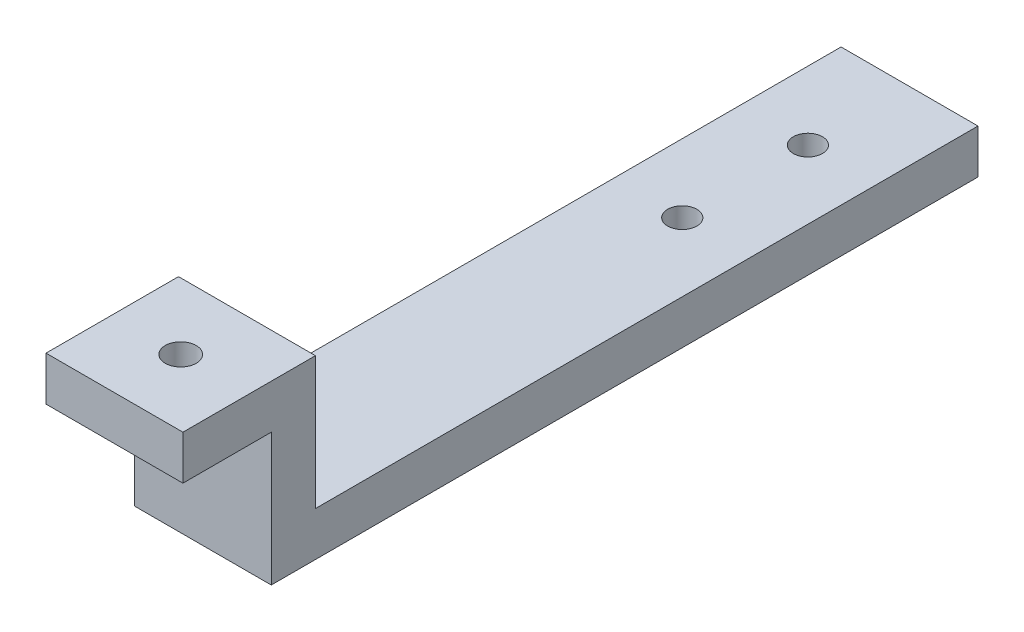
from build123d import *

# Parameters (mm, degrees)
EXTRUDE_THIN1_DEPTH            = 31
SKETCH6_R                      = 3.5
CUT_EXTRUDE1_DEPTH             = 10
SKETCH7_R                      = 3.302
CUT_EXTRUDE3_DEPTH             = 10.16
F_97_0_26_DIAMETER_HOLE1_D     = 6.604
F_97_0_26_DIAMETER_HOLE1_DEPTH = 25.4
F_97_0_26_DIAMETER_HOLE1_TIP   = 1.984041764


with BuildPart() as part:
    # Sketch1 → Extrude-Thin1 (new body)
    with BuildSketch(Plane(origin=(0, 0, 0), x_dir=(0, 0, -1), z_dir=(1, 0, 0))):
        Polygon((0, 0), (30, 0), (30, -29.972), (180, -29.972), (180, -39.972), (20, -39.972), (20, -10), (0, -10), align=None)
    extrude(amount=EXTRUDE_THIN1_DEPTH)

    # Sketch6 → Cut-Extrude1 (cut)
    with BuildSketch(Plane(origin=(0, 0, 0), x_dir=(1, 0, 0), z_dir=(0, 1, 0))):
        with Locations(Location((15.5, 15, 0), (0, 0, 270))):
            Circle(SKETCH6_R)
    extrude(amount=-CUT_EXTRUDE1_DEPTH, mode=Mode.SUBTRACT)

    # Sketch7 → Cut-Extrude3 (cut)
    with BuildSketch(Plane(origin=(0, -29.972, 0), x_dir=(1, 0, 0), z_dir=(0, 1, 0))):
        with Locations(Location((15.494, 157, 0), (0, 0, 270))):
            Circle(SKETCH7_R)
    extrude(amount=-CUT_EXTRUDE3_DEPTH, mode=Mode.SUBTRACT)

    # #97 (0.26) Diameter Hole1
    with Locations(Plane(origin=(0, -29.972, 0), x_dir=(1, 0, 0), z_dir=(0, 1, 0))):
        with Locations((15.494, 128.552)):
            Hole(F_97_0_26_DIAMETER_HOLE1_D / 2, depth=F_97_0_26_DIAMETER_HOLE1_DEPTH)
            with Locations((0, 0, -(F_97_0_26_DIAMETER_HOLE1_DEPTH + F_97_0_26_DIAMETER_HOLE1_TIP / 2))):  # 118° drill point
                Cone(0, F_97_0_26_DIAMETER_HOLE1_D / 2, F_97_0_26_DIAMETER_HOLE1_TIP, mode=Mode.SUBTRACT)


solid = part.part
